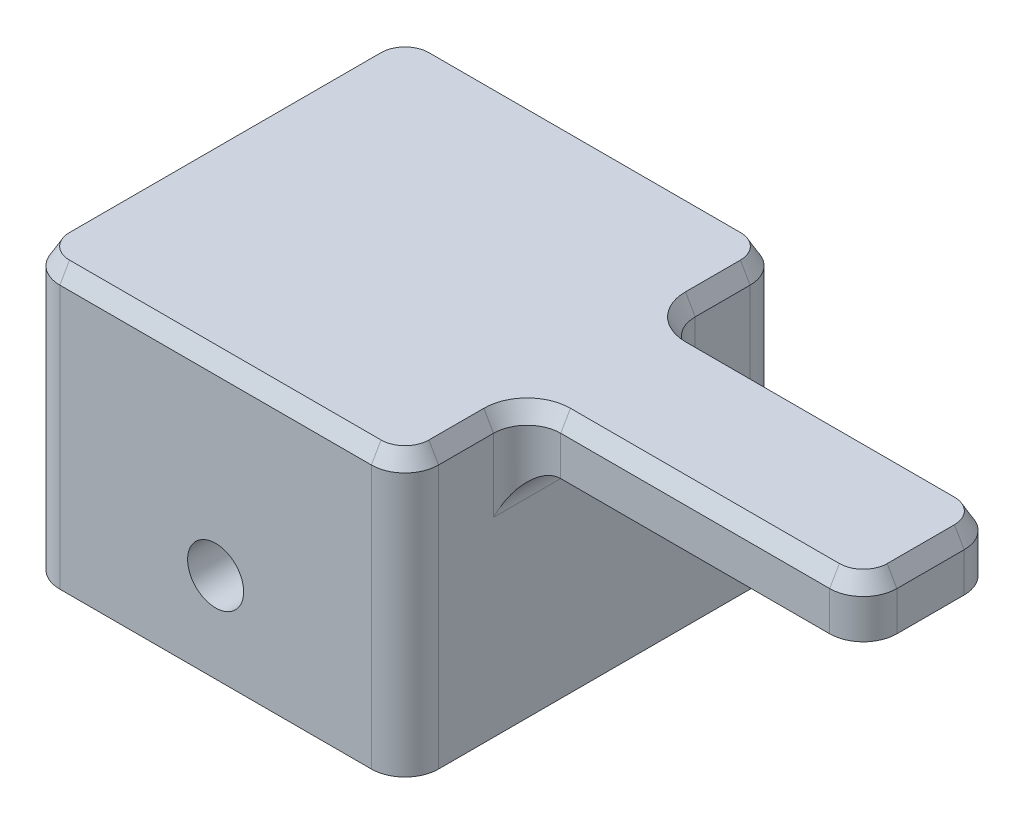
from build123d import *
from OCP.BRepFilletAPI import BRepFilletAPI_MakeChamfer

# Parameters (mm, degrees)
SKETCH1_W           = 33.8
SKETCH1_H           = 33.8
SKETCH1_W_2         = 25.8
SKETCH1_H_2         = 25.8
BOSS_EXTRUDE1_DEPTH = 20
SKETCH2_W           = 30
SKETCH2_H           = 12
SKETCH2_W_2         = 25.8
SKETCH2_H_2         = 25.8
BOSS_EXTRUDE2_DEPTH = 5
CUT_EXTRUDE1_REACH  = 64.985
SKETCH3_R           = 2.5
FILLET1_R           = 3
CHAMFER1_SIZE       = 1.5
CHAMFER1_SIZE2      = 0.866025404


with BuildPart() as part:
    # Sketch1 → Boss-Extrude1 (new body)
    with BuildSketch(Plane(origin=(0, 0, 0), x_dir=(1, 0, 0), z_dir=(0, 1, 0))):
        Rectangle(SKETCH1_W, SKETCH1_H)
        Rectangle(SKETCH1_W_2, SKETCH1_H_2, mode=Mode.SUBTRACT)
    extrude(amount=BOSS_EXTRUDE1_DEPTH)

    # Sketch2 → Boss-Extrude2 (add)
    # profile 1 of 3: a face of its own
    with BuildSketch(Plane(origin=(0, 20, 0), x_dir=(1, 0, 0), z_dir=(0, 1, 0))):
        with Locations((31.9, 0)):
            Rectangle(SKETCH2_W, SKETCH2_H)
    # profile 2 of 3: a face of its own
    with BuildSketch(Plane(origin=(0, 20, 0), x_dir=(1, 0, 0), z_dir=(0, 1, 0))):
        Polygon((16.9, 16.9), (-16.9, 16.9), (-16.9, -16.9), (16.9, -16.9), (16.9, -6), (16.9, 6), align=None)
        Rectangle(SKETCH2_W_2, SKETCH2_H_2, mode=Mode.SUBTRACT)
    # profile 3 of 3: a face of its own
    with BuildSketch(Plane(origin=(0, 20, 0), x_dir=(1, 0, 0), z_dir=(0, 1, 0))):
        Rectangle(SKETCH2_W_2, SKETCH2_H_2)
    extrude(amount=BOSS_EXTRUDE2_DEPTH)

    # Sketch3 → Cut-Extrude1 (cut, up to next)
    with BuildSketch(Plane.XY.offset(16.9), mode=Mode.PRIVATE) as cut_extrude1_sk1:
        with Locations((0, 8)):
            Circle(SKETCH3_R)
    cut_extrude1_tool1 = extrude(cut_extrude1_sk1.sketch, amount=-CUT_EXTRUDE1_REACH, mode=Mode.PRIVATE) & part.part
    add(cut_extrude1_tool1.solids().sort_by_distance((0, 8, 16.9))[0], mode=Mode.SUBTRACT)

    # Fillet1
    fillet1_edges = [part.edges().sort_by_distance(p)[0] for p in [
        (16.9, 20, 0),
        (16.9, 22.5, 6),
        (46.9, 22.5, 6),
        (46.9, 22.5, -6),
        (16.9, 22.5, -6),
        (-16.9, 12.5, 16.9),
        (-16.9, 12.5, -16.9),
        (16.9, 12.5, -16.9),
        (16.9, 12.5, 16.9),
    ]]
    fillet(fillet1_edges, radius=FILLET1_R)

    # Chamfer1: one chamfer whose edges measure the first distance from different faces: ONE call of the kernel's chamfer builder (chamfer() names one face for all edges)
    chamfer1_edges_1 = [part.edges().sort_by_distance(p)[0] for p in [
        (16.9, 25, -11.45),
        (16.9, 25, 11.45),
    ]]
    chamfer1_side_1 = [part.faces().sort_by_distance(p)[0] for p in [
        (16.9, 10.278584392, 0),
    ]]
    chamfer1_edges_2 = [part.edges().sort_by_distance(p)[0] for p in [
        (0, 25, 16.9),
    ]]
    chamfer1_side_2 = [part.faces().sort_by_distance(p)[0] for p in [
        (0, 12.63082894, 16.9),
    ]]
    chamfer1_edges_3 = [part.edges().sort_by_distance(p)[0] for p in [
        (31.9, 25, 6),
    ]]
    chamfer1_side_3 = [part.faces().sort_by_distance(p)[0] for p in [
        (31.9, 22.5, 6),
    ]]
    chamfer1_edges_4 = [part.edges().sort_by_distance(p)[0] for p in [
        (46.9, 25, 0),
    ]]
    chamfer1_side_4 = [part.faces().sort_by_distance(p)[0] for p in [
        (46.9, 22.5, 0),
    ]]
    chamfer1_edges_5 = [part.edges().sort_by_distance(p)[0] for p in [
        (31.9, 25, -6),
    ]]
    chamfer1_side_5 = [part.faces().sort_by_distance(p)[0] for p in [
        (31.9, 22.5, -6),
    ]]
    chamfer1_edges_6 = [part.edges().sort_by_distance(p)[0] for p in [
        (0, 25, -16.9),
    ]]
    chamfer1_side_6 = [part.faces().sort_by_distance(p)[0] for p in [
        (0, 12.5, -16.9),
    ]]
    chamfer1_edges_7 = [part.edges().sort_by_distance(p)[0] for p in [
        (-16.9, 25, 0),
    ]]
    chamfer1_side_7 = [part.faces().sort_by_distance(p)[0] for p in [
        (-16.9, 12.5, 0),
    ]]
    chamfer1_edges_8 = [part.edges().sort_by_distance(p)[0] for p in [
        (46.021320344, 25, 5.121320344),
    ]]
    chamfer1_side_8 = [part.faces().sort_by_distance(p)[0] for p in [
        (46.021320344, 22.5, 5.121320344),
    ]]
    chamfer1_edges_9 = [part.edges().sort_by_distance(p)[0] for p in [
        (46.021320344, 25, -5.121320344),
    ]]
    chamfer1_side_9 = [part.faces().sort_by_distance(p)[0] for p in [
        (46.021320344, 22.5, -5.121320344),
    ]]
    chamfer1_edges_10 = [part.edges().sort_by_distance(p)[0] for p in [
        (16.021320344, 25, -16.021320344),
    ]]
    chamfer1_side_10 = [part.faces().sort_by_distance(p)[0] for p in [
        (16.021320344, 12.5, -16.021320344),
    ]]
    chamfer1_edges_11 = [part.edges().sort_by_distance(p)[0] for p in [
        (-16.021320344, 25, -16.021320344),
    ]]
    chamfer1_side_11 = [part.faces().sort_by_distance(p)[0] for p in [
        (-16.021320344, 12.5, -16.021320344),
    ]]
    chamfer1_edges_12 = [part.edges().sort_by_distance(p)[0] for p in [
        (-16.021320344, 25, 16.021320344),
    ]]
    chamfer1_side_12 = [part.faces().sort_by_distance(p)[0] for p in [
        (-16.021320344, 12.5, 16.021320344),
    ]]
    chamfer1_edges_13 = [part.edges().sort_by_distance(p)[0] for p in [
        (16.021320344, 25, 16.021320344),
    ]]
    chamfer1_side_13 = [part.faces().sort_by_distance(p)[0] for p in [
        (16.021320344, 12.5, 16.021320344),
    ]]
    chamfer1_edges_14 = [part.edges().sort_by_distance(p)[0] for p in [
        (17.778679656, 25, -6.878679656),
    ]]
    chamfer1_side_14 = [part.faces().sort_by_distance(p)[0] for p in [
        (17.778679656, 21, -6.878679656),
    ]]
    chamfer1_edges_15 = [part.edges().sort_by_distance(p)[0] for p in [
        (17.778679656, 25, 6.878679656),
    ]]
    chamfer1_side_15 = [part.faces().sort_by_distance(p)[0] for p in [
        (17.778679656, 21, 6.878679656),
    ]]
    chamfer1 = BRepFilletAPI_MakeChamfer(part.part.solid().wrapped)
    for e in chamfer1_edges_1:
        chamfer1.Add(CHAMFER1_SIZE, CHAMFER1_SIZE2, e.wrapped, chamfer1_side_1[0].wrapped)  # the first distance lies on this face
    for e in chamfer1_edges_2:
        chamfer1.Add(CHAMFER1_SIZE, CHAMFER1_SIZE2, e.wrapped, chamfer1_side_2[0].wrapped)  # the first distance lies on this face
    for e in chamfer1_edges_3:
        chamfer1.Add(CHAMFER1_SIZE, CHAMFER1_SIZE2, e.wrapped, chamfer1_side_3[0].wrapped)  # the first distance lies on this face
    for e in chamfer1_edges_4:
        chamfer1.Add(CHAMFER1_SIZE, CHAMFER1_SIZE2, e.wrapped, chamfer1_side_4[0].wrapped)  # the first distance lies on this face
    for e in chamfer1_edges_5:
        chamfer1.Add(CHAMFER1_SIZE, CHAMFER1_SIZE2, e.wrapped, chamfer1_side_5[0].wrapped)  # the first distance lies on this face
    for e in chamfer1_edges_6:
        chamfer1.Add(CHAMFER1_SIZE, CHAMFER1_SIZE2, e.wrapped, chamfer1_side_6[0].wrapped)  # the first distance lies on this face
    for e in chamfer1_edges_7:
        chamfer1.Add(CHAMFER1_SIZE, CHAMFER1_SIZE2, e.wrapped, chamfer1_side_7[0].wrapped)  # the first distance lies on this face
    for e in chamfer1_edges_8:
        chamfer1.Add(CHAMFER1_SIZE, CHAMFER1_SIZE2, e.wrapped, chamfer1_side_8[0].wrapped)  # the first distance lies on this face
    for e in chamfer1_edges_9:
        chamfer1.Add(CHAMFER1_SIZE, CHAMFER1_SIZE2, e.wrapped, chamfer1_side_9[0].wrapped)  # the first distance lies on this face
    for e in chamfer1_edges_10:
        chamfer1.Add(CHAMFER1_SIZE, CHAMFER1_SIZE2, e.wrapped, chamfer1_side_10[0].wrapped)  # the first distance lies on this face
    for e in chamfer1_edges_11:
        chamfer1.Add(CHAMFER1_SIZE, CHAMFER1_SIZE2, e.wrapped, chamfer1_side_11[0].wrapped)  # the first distance lies on this face
    for e in chamfer1_edges_12:
        chamfer1.Add(CHAMFER1_SIZE, CHAMFER1_SIZE2, e.wrapped, chamfer1_side_12[0].wrapped)  # the first distance lies on this face
    for e in chamfer1_edges_13:
        chamfer1.Add(CHAMFER1_SIZE, CHAMFER1_SIZE2, e.wrapped, chamfer1_side_13[0].wrapped)  # the first distance lies on this face
    for e in chamfer1_edges_14:
        chamfer1.Add(CHAMFER1_SIZE, CHAMFER1_SIZE2, e.wrapped, chamfer1_side_14[0].wrapped)  # the first distance lies on this face
    for e in chamfer1_edges_15:
        chamfer1.Add(CHAMFER1_SIZE, CHAMFER1_SIZE2, e.wrapped, chamfer1_side_15[0].wrapped)  # the first distance lies on this face
    add(Compound.cast(chamfer1.Shape()), mode=Mode.REPLACE)


solid = part.part
